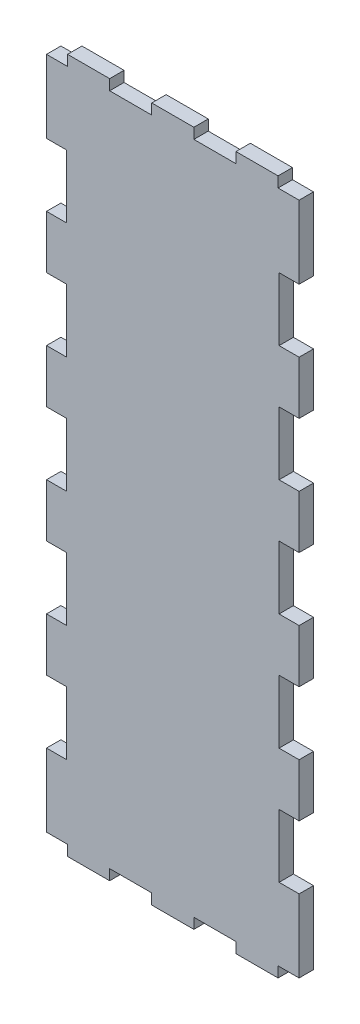
from build123d import *

# Parameters (mm, degrees)
SKETCH1_W           = 76.2
SKETCH1_H           = 203.2
BOSS_EXTRUDE1_DEPTH = 4.3434
SKETCH2_W           = 12.7
SKETCH2_H           = 6.35
BOSS_EXTRUDE2_DEPTH = 4.3434
SKETCH3_W           = 12.0904
SKETCH3_H           = 19.05
CUT_EXTRUDE1_DEPTH  = 112.571841199


with BuildPart() as part:
    # Sketch1 → Boss-Extrude1 (new body)
    with BuildSketch(Plane.XY):
        Rectangle(SKETCH1_W, SKETCH1_H)
    extrude(amount=BOSS_EXTRUDE1_DEPTH)

    # Sketch2 → Boss-Extrude2 (add)
    with BuildSketch(Plane.XY.offset(4.3434)):
        with Locations((0, 101.6)):
            Rectangle(SKETCH2_W, SKETCH2_H)
        with Locations((-25.4, 101.6)):
            Rectangle(SKETCH2_W, SKETCH2_H)
        with Locations((25.4, 101.6)):
            Rectangle(SKETCH2_W, SKETCH2_H)
        with Locations((25.4, -101.6)):
            Rectangle(SKETCH2_W, SKETCH2_H)
        with Locations((-25.4, -101.6)):
            Rectangle(SKETCH2_W, SKETCH2_H)
        with Locations((0, -101.6)):
            Rectangle(SKETCH2_W, SKETCH2_H)
    extrude(amount=-BOSS_EXTRUDE2_DEPTH)

    # Sketch3 → Cut-Extrude1 (cut, through all)
    with BuildSketch(Plane.XY.offset(4.3434)):
        with Locations((38.1, 0)):
            Rectangle(SKETCH3_W, SKETCH3_H)
        with Locations((38.1, 35.052)):
            Rectangle(SKETCH3_W, SKETCH3_H)
        with Locations((38.1, 70.104)):
            Rectangle(SKETCH3_W, SKETCH3_H)
        with Locations((38.1, -70.104)):
            Rectangle(SKETCH3_W, SKETCH3_H)
        with Locations((38.1, -35.052)):
            Rectangle(SKETCH3_W, SKETCH3_H)
        with Locations((-38.1, -35.052)):
            Rectangle(SKETCH3_W, SKETCH3_H)
        with Locations((-38.1, -70.104)):
            Rectangle(SKETCH3_W, SKETCH3_H)
        with Locations((-38.1, 70.104)):
            Rectangle(SKETCH3_W, SKETCH3_H)
        with Locations((-38.1, 35.052)):
            Rectangle(SKETCH3_W, SKETCH3_H)
        with Locations((-38.1, 0)):
            Rectangle(SKETCH3_W, SKETCH3_H)
    extrude(amount=-CUT_EXTRUDE1_DEPTH, mode=Mode.SUBTRACT)


solid = part.part
